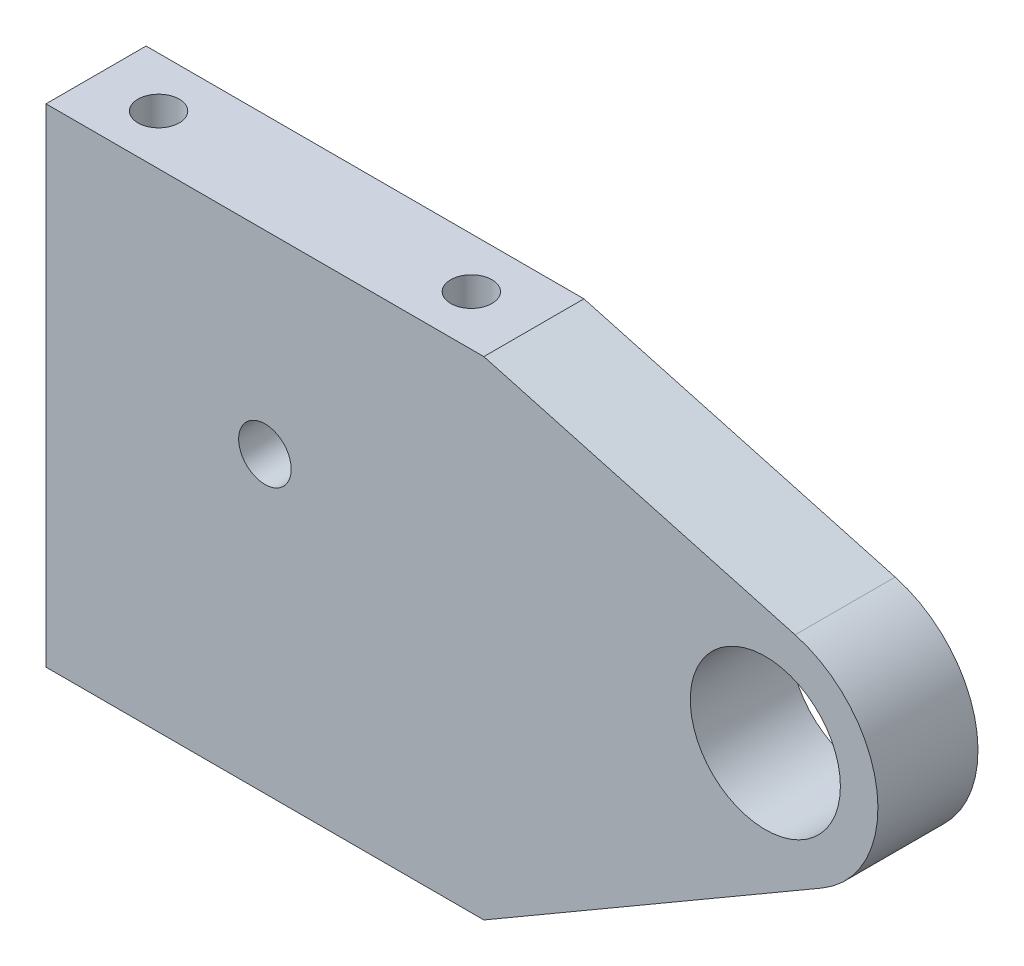
from build123d import *

# Parameters (mm, degrees)
SKETCH_1_W          = 35
SKETCH_1_H          = 39
SKETCH_1_R          = 2.1
EXTRUDE_1_DEPTH     = 8
SKETCH_2_R          = 1.6
CUT_EXTRUDE_1_DEPTH = 54.009433123
SKETCH_5_R          = 6
EXTRUDE_3_DEPTH     = 8
M4X0_7_1_D          = 3.3


with BuildPart() as part:
    # 草图1 → 凸台-拉伸1 (new body)
    with BuildSketch(Plane.XY):
        with Locations((17.5, 19.5)):
            Rectangle(SKETCH_1_W, SKETCH_1_H)
        with Locations((17.5, 23.5)):
            Circle(SKETCH_1_R, mode=Mode.SUBTRACT)
    extrude(amount=EXTRUDE_1_DEPTH)

    # 草图2 → 切除-拉伸1 (cut, through all)
    with BuildSketch(Plane(origin=(0, 39, 0), x_dir=(1, 0, 0), z_dir=(0, 1, 0))):
        with Locations(Location((5, -4, 0), (0, 0, 270))):
            Circle(SKETCH_2_R)
        with Locations(Location((30, -4, 0), (0, 0, 270))):
            Circle(SKETCH_2_R)
    extrude(amount=-CUT_EXTRUDE_1_DEPTH, mode=Mode.SUBTRACT)

    # 草图5 → 凸台-拉伸3 (add)
    with BuildSketch(Plane.XY.offset(8)):
        with BuildLine():
            Line((35, 39), (59.879399185, 32.179773011))
            ThreePointArc((59.879399185, 32.179773011), (66.424469933, 24.663544764), (62.025315767, 15.720442351))
            Line((62.025315767, 15.720442351), (35, 0))
            Line((35, 0), (35, 39))
        make_face()
        with Locations((57.5, 23.5)):
            Circle(SKETCH_5_R, mode=Mode.SUBTRACT)
    extrude(amount=-EXTRUDE_3_DEPTH)

    # M4x0.7 螺纹孔1 (through all)
    with Locations(Plane(origin=(0, 39, 0), x_dir=(1, 0, 0), z_dir=(0, 1, 0))):
        with Locations((5, -4), (30, -4)):
            Hole(M4X0_7_1_D / 2)


solid = part.part
